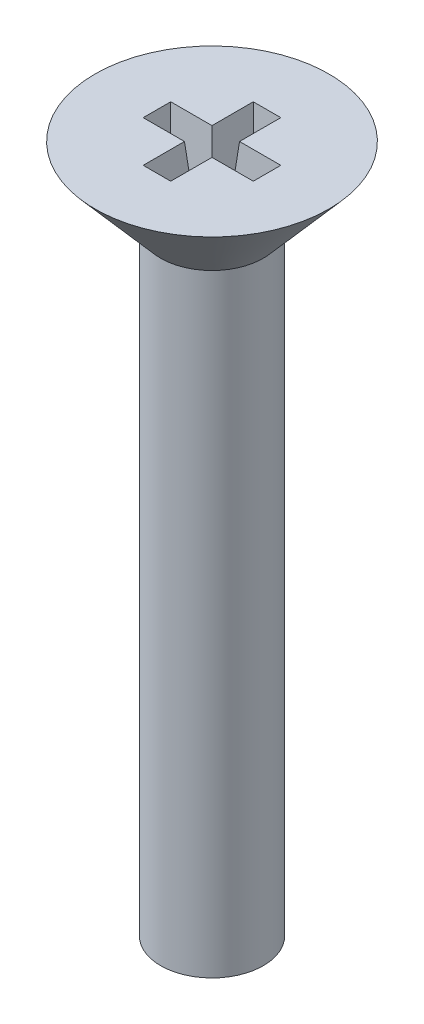
from build123d import *

# Parameters (mm, degrees)
CUT_EXTRUDE1_DEPTH = 2.159
CUT_EXTRUDE1_DRAFT = -5


with BuildPart() as part:
    # Sketch1 → Revolve1 (revolve)
    with BuildSketch(Plane.XY, mode=Mode.PRIVATE) as revolve1_sk:
        Polygon((1.4224, 0), (3.2385, 2.089184064), (0, 2.089184064), (0, 0), (0, -16.960815936), (1.4224, -16.960815936), align=None)
    revolve(revolve1_sk.sketch.rotate(Axis((0, 0, 0), (0, -1, 0)), 180), axis=Axis((0, 0, 0), (0, -1, 0)))


with BuildPart() as cut_extrude1_tool:
    # Sketch2 → Cut-Extrude1 (with draft: the straight prism first)
    with BuildSketch(Plane(origin=(0, 2.089184064, 0), x_dir=(1, 0, 0), z_dir=(0, 1, 0))):
        Polygon((-0.381, 1.524), (-0.381, 0.381), (-1.524, 0.381), (-1.524, -0.381), (-0.381, -0.381), (-0.381, -1.524), (0.381, -1.524), (0.381, -0.381), (1.524, -0.381), (1.524, 0.381), (0.381, 0.381), (0.381, 1.524), align=None)
    extrude(amount=-CUT_EXTRUDE1_DEPTH)
    # Cut-Extrude1: the draft: its side faces are tilted about the plane it starts from
    cut_extrude1_sides = [cut_extrude1_tool.faces().sort_by_distance(p)[0] for p in [
        (-0.381, 1.009684064, -0.9525),
        (-0.9525, 1.009684064, -0.381),
        (-1.524, 1.009684064, 0),
        (-0.9525, 1.009684064, 0.381),
        (-0.381, 1.009684064, 0.9525),
        (0, 1.009684064, 1.524),
        (0.381, 1.009684064, 0.9525),
        (0.9525, 1.009684064, 0.381),
        (1.524, 1.009684064, 0),
        (0.9525, 1.009684064, -0.381),
        (0.381, 1.009684064, -0.9525),
        (0, 1.009684064, -1.524),
    ]]
    draft(cut_extrude1_sides, Plane(origin=(0, 2.089184064, 0), x_dir=(1, 0, 0), z_dir=(0, 1, 0)), CUT_EXTRUDE1_DRAFT)


with BuildPart() as part_1:
    add(part.part)

    # Cut-Extrude1: cut by cut_extrude1_tool
    add(cut_extrude1_tool.part, mode=Mode.SUBTRACT)


solid = part_1.part
